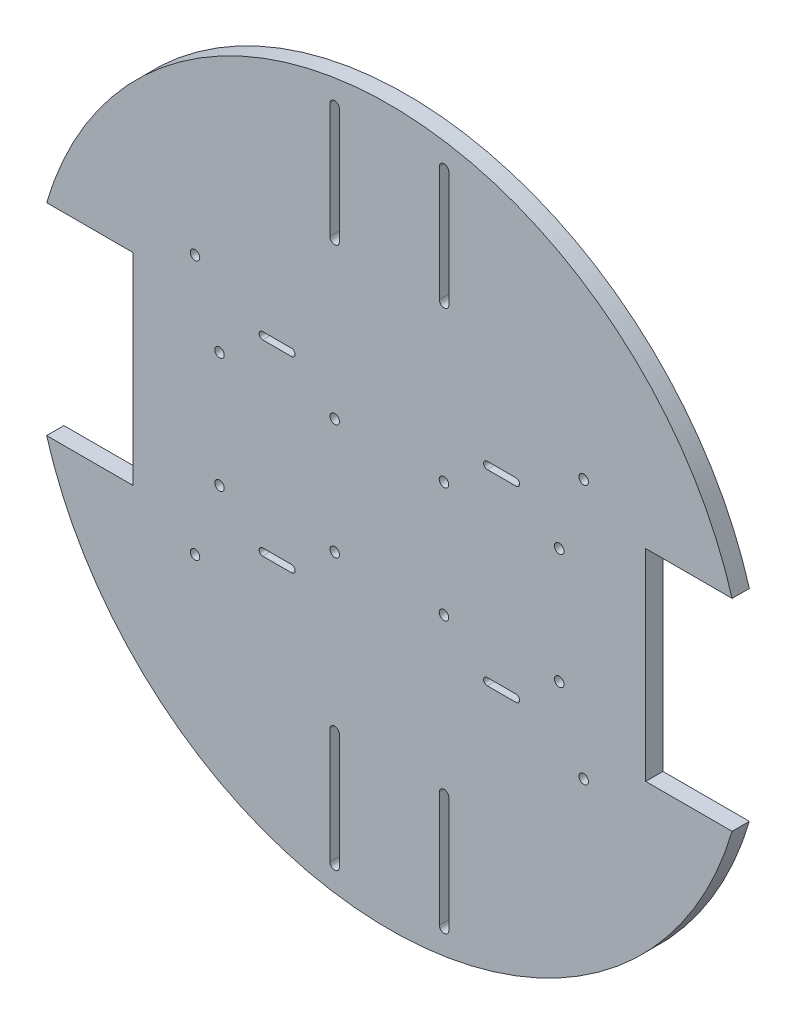
from build123d import *

# Parameters (mm, degrees)
ESQUISSE1_R             = 124
BOSS_EXTRU_1_DEPTH      = 6
ENL_V_MAT_EXTRU_1_DEPTH = 176.465096244
ESQUISSE3_R             = 1.65
ENL_V_MAT_EXTRU_3_DEPTH = 172.938942651
ESQUISSE5_R             = 1.65
ENL_V_MAT_EXTRU_4_DEPTH = 172.938942651
ENL_V_MAT_EXTRU_5_DEPTH = 172.938942651
ENL_V_MAT_EXTRU_6_DEPTH = 172.938942651


with BuildPart() as part:
    # Esquisse1 → Boss.-Extru.1 (new body)
    with BuildSketch(Plane.XY):
        Circle(ESQUISSE1_R)
    extrude(amount=BOSS_EXTRU_1_DEPTH)

    # Esquisse2 → Enlèv. mat.-Extru.1 (cut, through all)
    with BuildSketch(Plane.XY.offset(6)):
        with BuildLine():
            Line((-118.957975773, 35), (-88.957975773, 35))
            Line((-88.957975773, 35), (-88.957975773, -35))
            Line((-88.957975773, -35), (-118.957975773, -35))
            ThreePointArc((-118.957975773, -35), (-124, 0), (-118.957975773, 35))
        make_face()
        with BuildLine():
            Line((118.957975773, 35), (88.957975773, 35))
            Line((88.957975773, 35), (88.957975773, -35))
            Line((88.957975773, -35), (118.957975773, -35))
            ThreePointArc((118.957975773, -35), (124, 0), (118.957975773, 35))
        make_face()
    extrude(amount=-ENL_V_MAT_EXTRU_1_DEPTH, mode=Mode.SUBTRACT)

    # Esquisse3 → Enlèv. mat.-Extru.3 (cut, through all)
    with BuildSketch(Plane.XY.offset(6)):
        with Locations((-58.957975773, 20)):
            Circle(ESQUISSE3_R)
        with Locations((-18.957975773, 20)):
            Circle(ESQUISSE3_R)
        with Locations((-18.957975773, -20)):
            Circle(ESQUISSE3_R)
        with Locations((-58.957975773, -20)):
            Circle(ESQUISSE3_R)
    enl_v_mat_extru_3 = extrude(amount=-ENL_V_MAT_EXTRU_3_DEPTH, mode=Mode.SUBTRACT)

    # Esquisse5 → Enlèv. mat.-Extru.4 (cut, through all)
    with BuildSketch(Plane.XY.offset(6)):
        with Locations((-67.457975773, 45)):
            Circle(ESQUISSE5_R)
        with Locations((-67.457975773, -45)):
            Circle(ESQUISSE5_R)
    enl_v_mat_extru_4 = extrude(amount=-ENL_V_MAT_EXTRU_4_DEPTH, mode=Mode.SUBTRACT)

    # Esquisse6 → Enlèv. mat.-Extru.5 (cut, through all)
    with BuildSketch(Plane.XY.offset(6)):
        with BuildLine():
            Line((-43.957975773, 33.75), (-33.957975773, 33.75))
            ThreePointArc((-33.957975773, 33.75), (-32.707975773, 32.5), (-33.957975773, 31.25))
            Line((-33.957975773, 31.25), (-43.957975773, 31.25))
            ThreePointArc((-43.957975773, 31.25), (-45.207975773, 32.5), (-43.957975773, 33.75))
        make_face()
        with BuildLine():
            Line((-43.957975773, -31.25), (-33.957975773, -31.25))
            ThreePointArc((-33.957975773, -31.25), (-32.707975773, -32.5), (-33.957975773, -33.75))
            Line((-33.957975773, -33.75), (-43.957975773, -33.75))
            ThreePointArc((-43.957975773, -33.75), (-45.207975773, -32.5), (-43.957975773, -31.25))
        make_face()
    enl_v_mat_extru_5 = extrude(amount=-ENL_V_MAT_EXTRU_5_DEPTH, mode=Mode.SUBTRACT)

    # Esquisse7 → Enlèv. mat.-Extru.6 (cut, through all)
    with BuildSketch(Plane.XY.offset(6)):
        with BuildLine():
            Line((-17.35, 114), (-17.35, 74))
            ThreePointArc((-17.35, 74), (-19, 72.35), (-20.65, 74))
            Line((-20.65, 74), (-20.65, 114))
            ThreePointArc((-20.65, 114), (-19, 115.65), (-17.35, 114))
        make_face()
        with BuildLine():
            Line((-17.35, -74), (-17.35, -114))
            ThreePointArc((-17.35, -114), (-19, -115.65), (-20.65, -114))
            Line((-20.65, -114), (-20.65, -74))
            ThreePointArc((-20.65, -74), (-19, -72.35), (-17.35, -74))
        make_face()
    enl_v_mat_extru_6 = extrude(amount=-ENL_V_MAT_EXTRU_6_DEPTH, mode=Mode.SUBTRACT)

    # Symétrie2: Enlèv. mat.-Extru.3, Enlèv. mat.-Extru.4, Enlèv. mat.-Extru.5, Enlèv. mat.-Extru.6 across plane
    add(enl_v_mat_extru_3.mirror(Plane(origin=(0, 0, 0), x_dir=(0, 0, 1), z_dir=(1, 0, 0))), mode=Mode.SUBTRACT)
    add(enl_v_mat_extru_4.mirror(Plane(origin=(0, 0, 0), x_dir=(0, 0, 1), z_dir=(1, 0, 0))), mode=Mode.SUBTRACT)
    add(enl_v_mat_extru_5.mirror(Plane(origin=(0, 0, 0), x_dir=(0, 0, 1), z_dir=(1, 0, 0))), mode=Mode.SUBTRACT)
    add(enl_v_mat_extru_6.mirror(Plane(origin=(0, 0, 0), x_dir=(0, 0, 1), z_dir=(1, 0, 0))), mode=Mode.SUBTRACT)


solid = part.part
